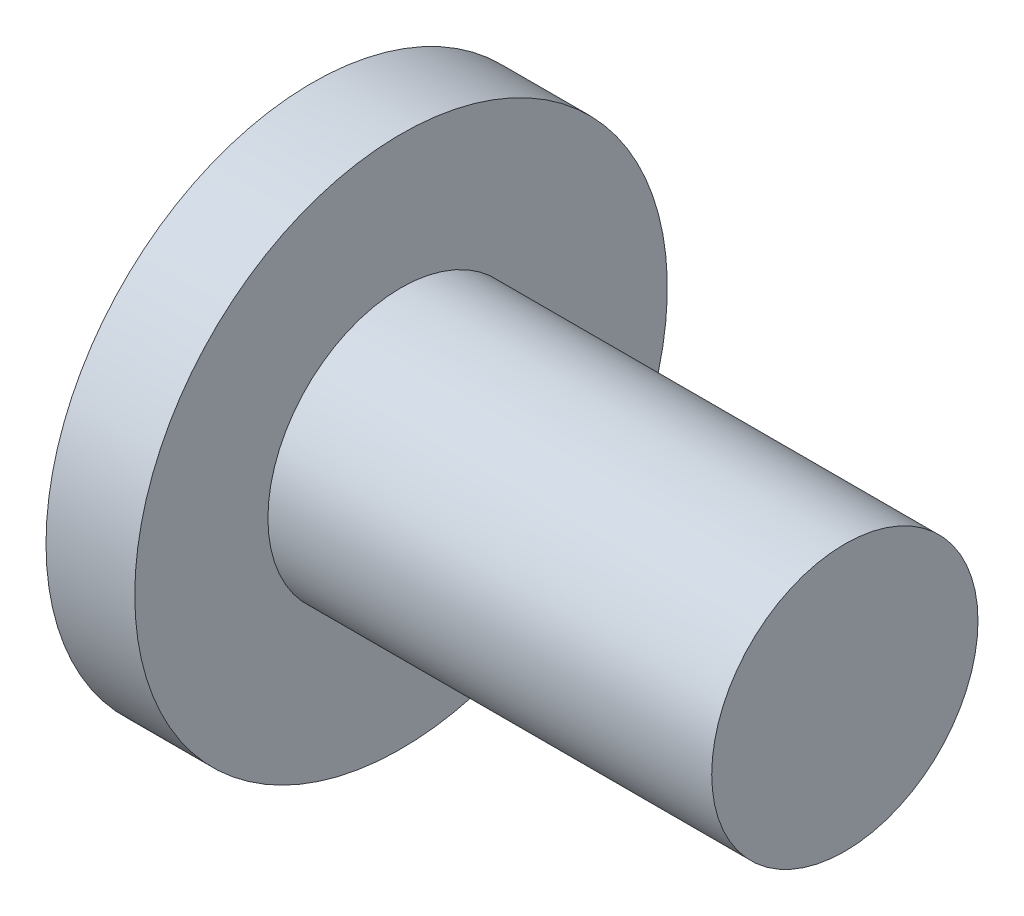
from build123d import *


with BuildPart() as part:
    # Sketch1 → Revolve1 (revolve)
    with BuildSketch(Plane.XY, mode=Mode.PRIVATE) as revolve1_sk:
        Polygon((0, 0), (-12, 0), (-12, 6), (-10, 6), (-10, 3), (0, 3), align=None)
    revolve(revolve1_sk.sketch.rotate(Axis((0, 0, 0), (1, 0, 0)), 90), axis=Axis((0, 0, 0), (1, 0, 0)))


solid = part.part
